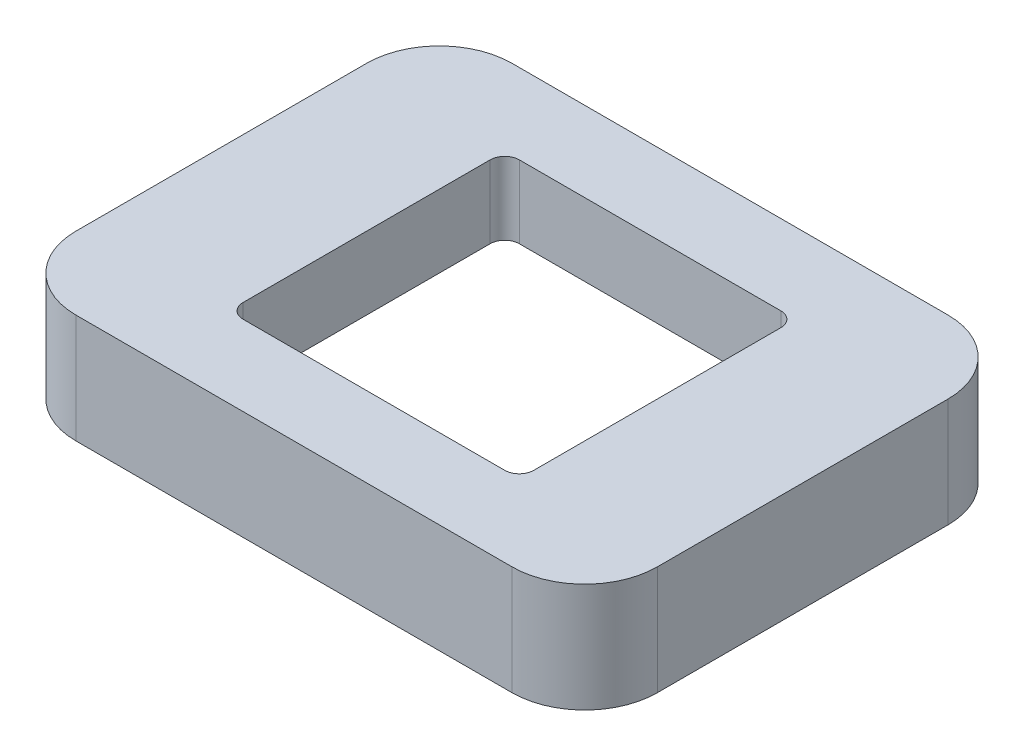
from build123d import *

# Parameters (mm, degrees)
BOSS_EXTRU_1_DEPTH      = 15
ENL_V_MAT_EXTRU_1_DEPTH = 5
ESQUISSE3_R             = 2.8
ENL_V_MAT_EXTRU_2_DEPTH = 8.1


with BuildPart() as part:
    # Esquisse1 → Boss.-Extru.1 (new body)
    with BuildSketch(Plane(origin=(0, 0, 0), x_dir=(1, 0, 0), z_dir=(0, 1, 0))):
        with BuildLine():
            Line((10, 0), (70, 0))
            ThreePointArc((70, 0), (77.071067812, -2.928932188), (80, -10))
            Line((80, -10), (80, -50))
            ThreePointArc((80, -50), (77.071067812, -57.071067812), (70, -60))
            Line((70, -60), (10, -60))
            ThreePointArc((10, -60), (2.928932188, -57.071067812), (0, -50))
            Line((0, -50), (0, -10))
            ThreePointArc((0, -10), (2.928932188, -2.928932188), (10, 0))
        make_face()
        with BuildLine():
            Line((58, -49), (22, -49))
            ThreePointArc((22, -49), (20.585786438, -48.414213562), (20, -47))
            Line((20, -47), (20, -13))
            ThreePointArc((20, -13), (20.585786438, -11.585786438), (22, -11))
            Line((22, -11), (58, -11))
            ThreePointArc((58, -11), (59.414213562, -11.585786438), (60, -13))
            Line((60, -13), (60, -47))
            ThreePointArc((60, -47), (59.414213562, -48.414213562), (58, -49))
        make_face(mode=Mode.SUBTRACT)
    extrude(amount=BOSS_EXTRU_1_DEPTH)

    # Esquisse2 → Enlèv. mat.-Extru.1 (cut)
    with BuildSketch(Plane.XZ):
        with BuildLine():
            Line((8, 57), (72, 57))
            ThreePointArc((72, 57), (75.535533906, 55.535533906), (77, 52))
            Line((77, 52), (77, 8))
            ThreePointArc((77, 8), (75.535533906, 4.464466094), (72, 3))
            Line((72, 3), (8, 3))
            ThreePointArc((8, 3), (4.464466094, 4.464466094), (3, 8))
            Line((3, 8), (3, 52))
            ThreePointArc((3, 52), (4.464466094, 55.535533906), (8, 57))
        make_face()
    extrude(amount=-ENL_V_MAT_EXTRU_1_DEPTH, mode=Mode.SUBTRACT)

    # Esquisse3 → Enlèv. mat.-Extru.2 (cut)
    with BuildSketch(Plane.XZ.offset(-5)):
        with Locations(Location((70, 10, 0), (0, 0, 270))):
            Circle(ESQUISSE3_R)
        with Locations(Location((70, 50, 0), (0, 0, 270))):
            Circle(ESQUISSE3_R)
        with Locations(Location((10, 10, 0), (0, 0, 270))):
            Circle(ESQUISSE3_R)
        with Locations(Location((10, 50, 0), (0, 0, 270))):
            Circle(ESQUISSE3_R)
    extrude(amount=-ENL_V_MAT_EXTRU_2_DEPTH, mode=Mode.SUBTRACT)


solid = part.part
